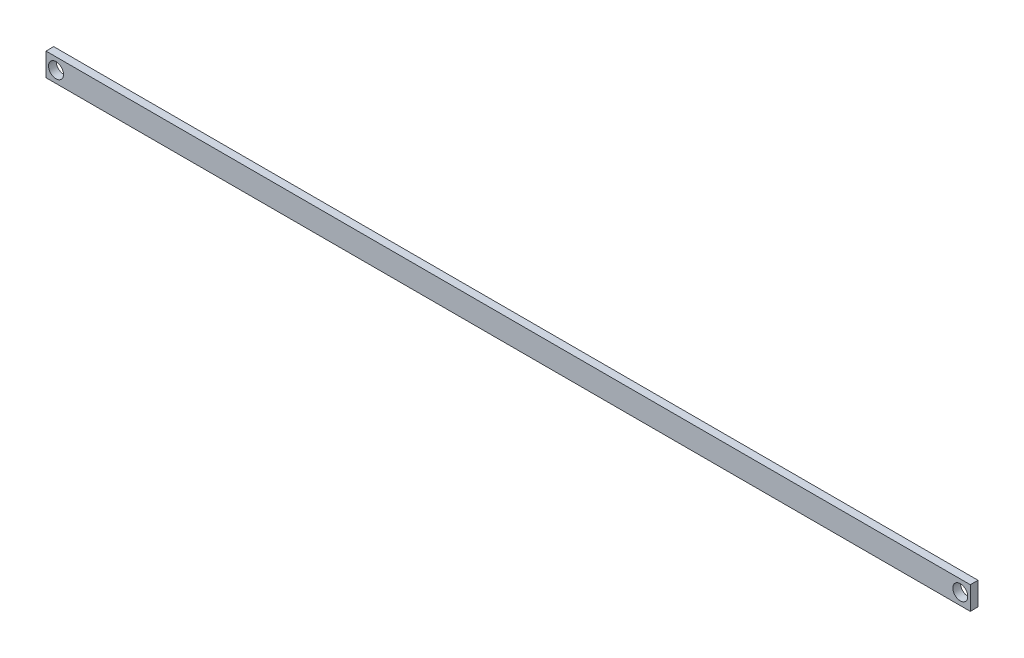
from build123d import *

# Parameters (mm, degrees)
SKETCH1_W           = 600
SKETCH1_H           = 15
SKETCH1_R           = 4.85
BOSS_EXTRUDE1_DEPTH = 5


with BuildPart() as part:
    # Sketch1 → Boss-Extrude1 (new body)
    with BuildSketch(Plane.XY):
        with Locations((300, -7.5)):
            Rectangle(SKETCH1_W, SKETCH1_H)
        with Locations((6.5, -7.5)):
            Circle(SKETCH1_R, mode=Mode.SUBTRACT)
        with Locations((593.5, -7.5)):
            Circle(SKETCH1_R, mode=Mode.SUBTRACT)
    extrude(amount=-BOSS_EXTRUDE1_DEPTH)


solid = part.part
